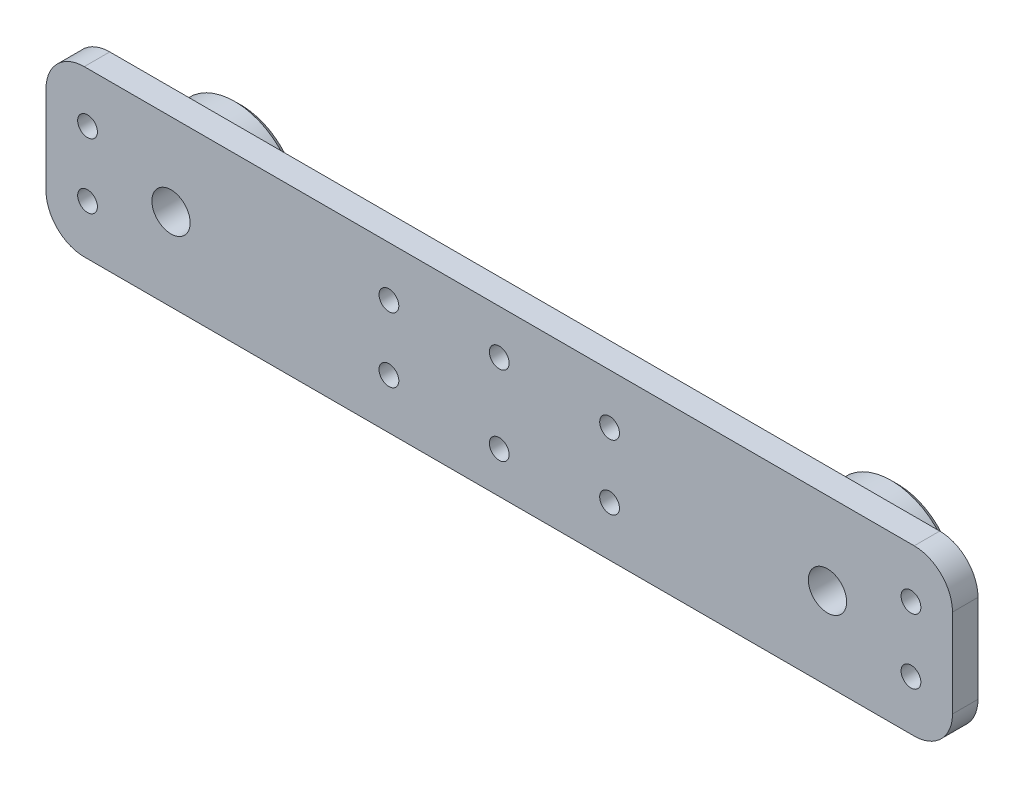
from build123d import *

# Parameters (mm, degrees)
SKETCH1_W                      = 142.142719433
SKETCH1_H                      = 25.841975708
BOSS_EXTRUDE1_DEPTH            = 4
SKETCH2_W                      = 10
SKETCH2_H                      = 7
SKETCH3_W                      = 10
SKETCH3_H                      = 7
F_3_1_3_1_DIAMETER_HOLE1_D     = 3.1
F_3_1_3_1_DIAMETER_HOLE1_DEPTH = 11
F_6_0_6_DIAMETER_HOLE1_D       = 6
CHAMFER1_SIZE                  = 1
FILLET1_R                      = 6


with BuildPart() as part:
    # Sketch1 → Boss-Extrude1 (new body)
    with BuildSketch(Plane(origin=(0, 0, -8.279012494), x_dir=(-1, 0, 0), z_dir=(0, 0, -1))):
        with Locations((-40.928641953, 22.079012221)):
            Rectangle(SKETCH1_W, SKETCH1_H)
    extrude(amount=-BOSS_EXTRUDE1_DEPTH)

    # Sketch2 → Revolve1 (revolve)
    with BuildSketch(Plane(origin=(0, 22.079011948, 0), x_dir=(1, 0, 0), z_dir=(0, 1, 0))):
        with Locations((-5.54, 11.779012494)):
            Rectangle(SKETCH2_W, SKETCH2_H)
    revolve(axis=Axis((-10.54, 22.079011948, -15.279012494), (0, 0, 1)))

    # Sketch3 → Revolve2 (revolve)
    with BuildSketch(Plane(origin=(0, 22.079011948, 0), x_dir=(1, 0, 0), z_dir=(0, 1, 0))):
        with Locations((97.397001672, 11.779012494)):
            Rectangle(SKETCH3_W, SKETCH3_H)
    revolve(axis=Axis((92.397001672, 22.079011948, -15.279012494), (0, 0, 1)))

    # Ø3.1 (3.1) Diameter Hole1
    with Locations(Plane.XY.offset(-4.279012494)):
        with Locations((40.928641952, 28.039506364), (40.928641952, 15.618518294), (58.227283905, 27.164012494), (23.63, 27.164011948), (-23.63, 27.164011948), (-23.63, 16.994011948), (23.63, 16.994011948), (58.227283905, 16.994012494), (105.487283905, 27.164012494), (105.487283905, 16.994012494)):
            Hole(F_3_1_3_1_DIAMETER_HOLE1_D / 2, depth=F_3_1_3_1_DIAMETER_HOLE1_DEPTH)

    # Ø6.0 (6) Diameter Hole1 (through all)
    with Locations(Plane(origin=(0, 0, -15.279012494), x_dir=(-1, 0, 0), z_dir=(0, 0, -1))):
        with Locations((-92.397001672, 22.079344118), (10.54, 22.079011948)):
            Hole(F_6_0_6_DIAMETER_HOLE1_D / 2)

    # Chamfer1
    chamfer1_edges = [part.edges().sort_by_distance(p)[0] for p in [
        (-20.54, 22.079011948, -8.279012494),
        (-20.54, 22.079011948, -15.279012494),
        (82.397001672, 22.079011948, -8.279012494),
        (82.397001672, 22.079011948, -15.279012494),
    ]]
    chamfer(chamfer1_edges, length=CHAMFER1_SIZE)

    # Fillet1
    fillet1_edges = [part.edges().sort_by_distance(p)[0] for p in [
        (112.000001669, 35.000000075, -6.279012494),
        (-30.142717764, 35.000000075, -6.279012494),
        (-30.142717764, 9.158024367, -6.279012494),
        (112.000001669, 9.158024367, -6.279012494),
    ]]
    fillet(fillet1_edges, radius=FILLET1_R)


solid = part.part
